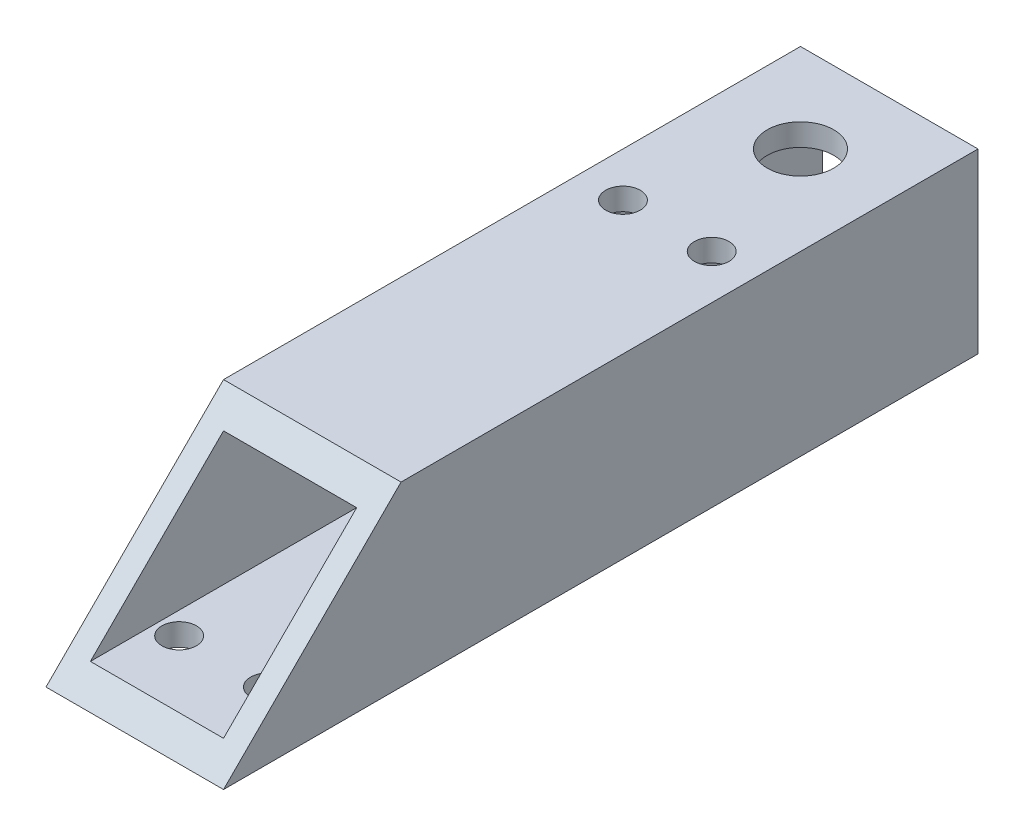
from build123d import *

# Parameters (mm, degrees)
SKETCH1_W           = 25.4
SKETCH1_H           = 25.4
BOSS_EXTRUDE1_DEPTH = 107.95
SKETCH2_W           = 19.05
SKETCH2_H           = 19.05
CUT_EXTRUDE1_DEPTH  = 110.433918417
CUT_EXTRUDE2_DEPTH  = 112.622813528
SKETCH5_R           = 2.4765
CUT_EXTRUDE3_DEPTH  = 112.622813528
SKETCH7_R           = 4.7625
CUT_EXTRUDE5_DEPTH  = 112.622813528
SKETCH8_R           = 2.4765
CUT_EXTRUDE6_DEPTH  = 112.622813528


with BuildPart() as part:
    # Sketch1 → Boss-Extrude1 (new body)
    with BuildSketch(Plane.XY):
        Rectangle(SKETCH1_W, SKETCH1_H)
    extrude(amount=BOSS_EXTRUDE1_DEPTH)

    # Sketch2 → Cut-Extrude1 (cut, through all)
    with BuildSketch(Plane.XY.offset(107.95)):
        Rectangle(SKETCH2_W, SKETCH2_H)
    extrude(amount=-CUT_EXTRUDE1_DEPTH, mode=Mode.SUBTRACT)

    # Sketch4 → Cut-Extrude2 (cut, through all)
    with BuildSketch(Plane(origin=(12.7, 0, 0), x_dir=(0, 0, -1), z_dir=(1, 0, 0))):
        Polygon((-107.95, 12.7), (-82.55, 12.7), (-107.95, -12.7), align=None)
    extrude(amount=-CUT_EXTRUDE2_DEPTH, mode=Mode.SUBTRACT)

    # Sketch5 → Cut-Extrude3 (cut, through all)
    with BuildSketch(Plane.XZ.offset(12.7)):
        with Locations(Location((-6.35, 95.25, 0), (0, 0, 270))):
            Circle(SKETCH5_R)
        with Locations(Location((6.35, 95.25, 0), (0, 0, 270))):
            Circle(SKETCH5_R)
    extrude(amount=-CUT_EXTRUDE3_DEPTH, mode=Mode.SUBTRACT)

    # Sketch7 → Cut-Extrude5 (cut, through all)
    with BuildSketch(Plane(origin=(0, 12.7, 0), x_dir=(1, 0, 0), z_dir=(0, 1, 0))):
        with Locations(Location((0, -12.7, 0), (0, 0, 270))):
            Circle(SKETCH7_R)
    extrude(amount=-CUT_EXTRUDE5_DEPTH, mode=Mode.SUBTRACT)

    # Sketch8 → Cut-Extrude6 (cut, through all)
    with BuildSketch(Plane.XZ.offset(12.7)):
        with Locations(Location((6.35, 31.75, 0), (0, 0, 270))):
            Circle(SKETCH8_R)
        with Locations(Location((-6.35, 31.75, 0), (0, 0, 270))):
            Circle(SKETCH8_R)
    extrude(amount=-CUT_EXTRUDE6_DEPTH, mode=Mode.SUBTRACT)


solid = part.part
